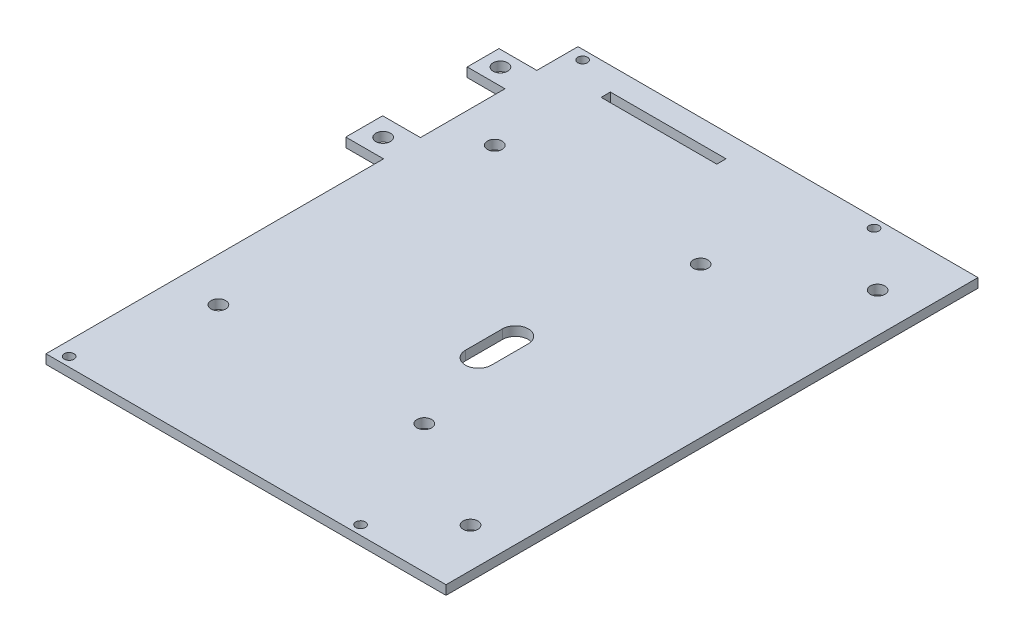
from build123d import *

# Parameters (mm, degrees)
SKETCH_1_R      = 1.05
SKETCH_1_R_2    = 1.585
SKETCH_1_W      = 25
SKETCH_1_H      = 2
EXTRUDE_1_DEPTH = 2


with BuildPart() as part:
    # 草图1 → 凸台-拉伸1 (new body)
    with BuildSketch(Plane(origin=(0, 0, 0), x_dir=(1, 0, 0), z_dir=(0, 1, 0))):
        Polygon((86.47, 0), (0, 0), (0, -8.9), (-8.17, -8.9), (-8.17, -15.78), (0, -15.78), (0, -34.06), (-8.17, -34.06), (-8.17, -42.03), (0, -42.03), (0, -115), (86.47, -115), align=None)
        with Locations(Location((3, -113, 0), (0, 0, 270))):
            Circle(SKETCH_1_R, mode=Mode.SUBTRACT)
        with Locations(Location((9.47, -87.2, 0), (0, 0, 270))):
            Circle(SKETCH_1_R_2, mode=Mode.SUBTRACT)
        with Locations(Location((53.97, -87.2, 0), (0, 0, 270))):
            Circle(SKETCH_1_R_2, mode=Mode.SUBTRACT)
        with Locations(Location((66, -113, 0), (0, 0, 270))):
            Circle(SKETCH_1_R, mode=Mode.SUBTRACT)
        with Locations(Location((77.97, -101.2, 0), (0, 0, 270))):
            Circle(SKETCH_1_R_2, mode=Mode.SUBTRACT)
        with BuildLine():
            ThreePointArc((44.67, -61), (47.47, -58.2), (50.27, -61))
            Line((50.27, -61), (50.27, -69))
            ThreePointArc((50.27, -69), (47.47, -71.8), (44.67, -69))
            Line((44.67, -69), (44.67, -61))
        make_face(mode=Mode.SUBTRACT)
        with Locations(Location((9.47, -27.46, 0), (0, 0, 270))):
            Circle(SKETCH_1_R_2, mode=Mode.SUBTRACT)
        with Locations(Location((3, -2, 0), (0, 0, 270))):
            Circle(SKETCH_1_R, mode=Mode.SUBTRACT)
        with Locations((24.5, -6)):
            Rectangle(SKETCH_1_W, SKETCH_1_H, mode=Mode.SUBTRACT)
        with Locations(Location((53.97, -27.46, 0), (0, 0, 270))):
            Circle(SKETCH_1_R_2, mode=Mode.SUBTRACT)
        with Locations(Location((66, -2, 0), (0, 0, 270))):
            Circle(SKETCH_1_R, mode=Mode.SUBTRACT)
        with Locations(Location((77.97, -13.2, 0), (0, 0, 270))):
            Circle(SKETCH_1_R_2, mode=Mode.SUBTRACT)
        with Locations(Location((-4.57, -12.2, 0), (0, 0, 270))):
            Circle(SKETCH_1_R_2, mode=Mode.SUBTRACT)
        with Locations(Location((-4.07, -38.06, 0), (0, 0, 270))):
            Circle(SKETCH_1_R_2, mode=Mode.SUBTRACT)
    extrude(amount=EXTRUDE_1_DEPTH)


solid = part.part
